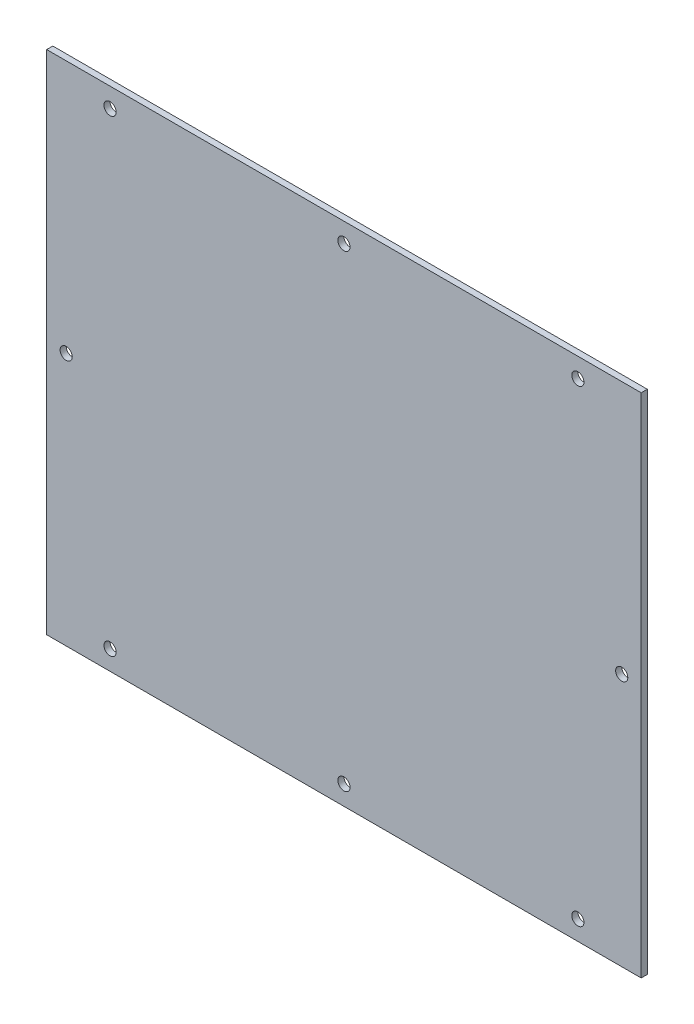
from build123d import *

# Parameters (mm, degrees)
SKETCH1_W           = 387.35
SKETCH1_H           = 330.2
SKETCH1_R           = 3.96875
BOSS_EXTRUDE1_DEPTH = 3.9878


with BuildPart() as part:
    # Sketch1 → Boss-Extrude1 (new body)
    with BuildSketch(Plane.XY):
        Rectangle(SKETCH1_W, SKETCH1_H)
        with Locations((-180.975, 0)):
            Circle(SKETCH1_R, mode=Mode.SUBTRACT)
        with Locations((0, 152.4)):
            Circle(SKETCH1_R, mode=Mode.SUBTRACT)
        with Locations((152.4, 152.4)):
            Circle(SKETCH1_R, mode=Mode.SUBTRACT)
        with Locations((-152.4, 152.4)):
            Circle(SKETCH1_R, mode=Mode.SUBTRACT)
        with Locations(Location((180.975, 0, 0), (0, 0, 180))):
            Circle(SKETCH1_R, mode=Mode.SUBTRACT)
        with Locations(Location((152.4, -152.4, 0), (0, 0, 180))):
            Circle(SKETCH1_R, mode=Mode.SUBTRACT)
        with Locations(Location((0, -152.4, 0), (0, 0, 180))):
            Circle(SKETCH1_R, mode=Mode.SUBTRACT)
        with Locations(Location((-152.4, -152.4, 0), (0, 0, 180))):
            Circle(SKETCH1_R, mode=Mode.SUBTRACT)
    extrude(amount=BOSS_EXTRUDE1_DEPTH)


solid = part.part
